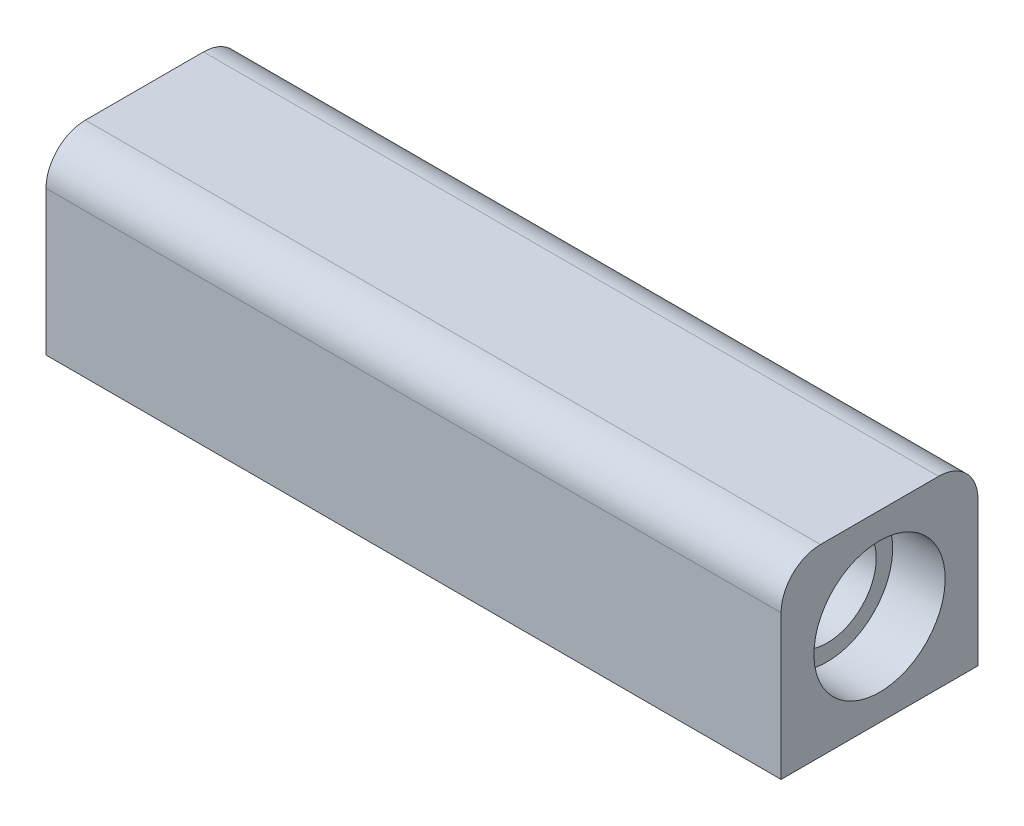
from build123d import *

# Parameters (mm, degrees)
SKETCH1_W                = 56
SKETCH1_H                = 14
BOSS_EXTRUDE1_DEPTH      = 15
F_3_0_3_DIAMETER_HOLE1_D = 7.5
SKETCH5_R                = 5
CUT_EXTRUDE1_DEPTH       = 4
CUT_EXTRUDE2_START       = -4
SKETCH6_R                = 5
CUT_EXTRUDE2_DEPTH       = 4
FILLET1_R                = 3


with BuildPart() as part:
    # Sketch1 → Boss-Extrude1 (new body)
    with BuildSketch(Plane.XY):
        Rectangle(SKETCH1_W, SKETCH1_H)
    extrude(amount=BOSS_EXTRUDE1_DEPTH)

    # Ø3.0 (3) Diameter Hole1 (through all)
    with Locations(Plane(origin=(28, 0, 0), x_dir=(0, 0, -1), z_dir=(1, 0, 0))):
        with Locations((-7.5, 0)):
            Hole(F_3_0_3_DIAMETER_HOLE1_D / 2)

    # Sketch5 → Cut-Extrude1 (cut)
    with BuildSketch(Plane(origin=(28, 0, 0), x_dir=(0, 0, -1), z_dir=(1, 0, 0))):
        with Locations(Location((-7.5, 0, 0), (0, 0, 90))):
            Circle(SKETCH5_R)
    extrude(amount=-CUT_EXTRUDE1_DEPTH, mode=Mode.SUBTRACT)

    # Sketch6 → Cut-Extrude2 (cut)
    with BuildSketch(Plane.ZY.offset(28).offset(CUT_EXTRUDE2_START)):
        with Locations(Location((7.5, 0, 0), (0, 0, 90))):
            Circle(SKETCH6_R)
    extrude(amount=CUT_EXTRUDE2_DEPTH, mode=Mode.SUBTRACT)

    # Fillet1
    fillet1_edges = [part.edges().sort_by_distance(p)[0] for p in [
        (0, 7, 15),
        (0, 7, 0),
    ]]
    fillet(fillet1_edges, radius=FILLET1_R)


solid = part.part
